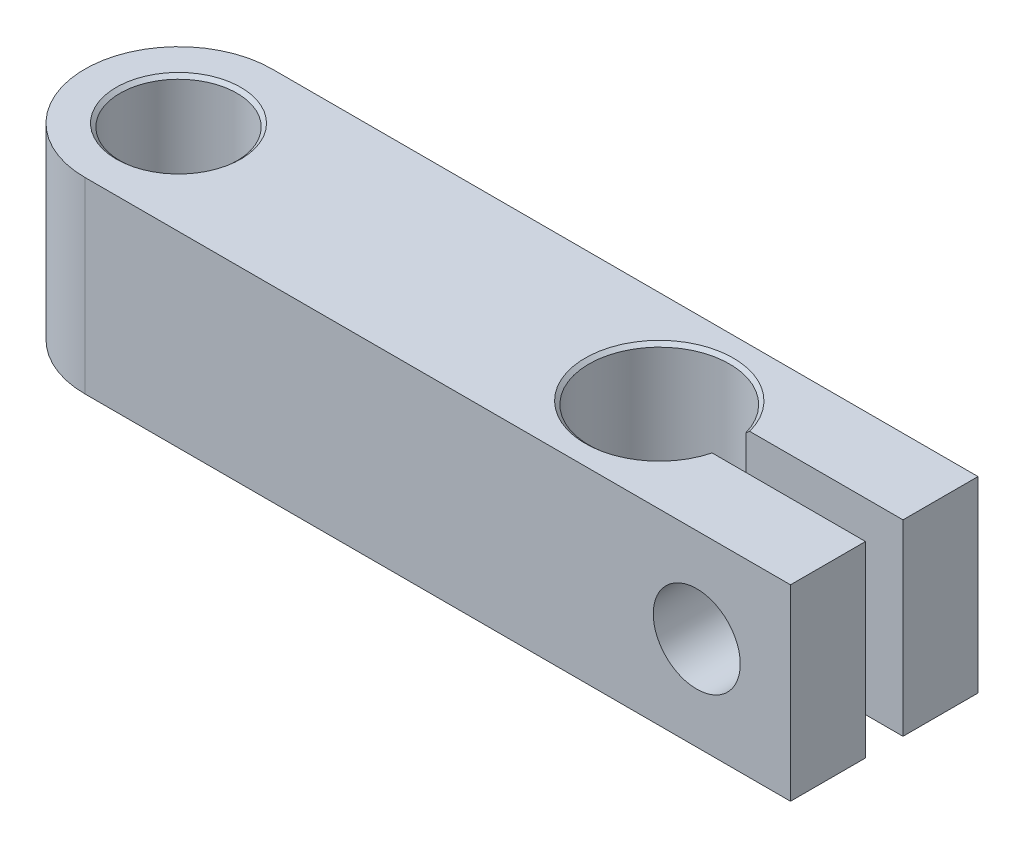
from build123d import *
from OCP.BRepFilletAPI import BRepFilletAPI_MakeChamfer

# Parameters (mm, degrees)
SKETCH1_R                  = 1.9812
SKETCH1_R_2                = 2.38125
BOSS_EXTRUDE1_DEPTH        = 6.35
SKETCH2_W                  = 7.62
SKETCH2_H                  = 1.27
CUT_EXTRUDE1_DEPTH         = 26.532761738
CHAMFER1_SIZE              = 0.127
CHAMFER1_SIZE2             = 0.110399416
F_4_40_TAPPED_HOLE1_REACH  = 27.533
F_4_40_TAPPED_HOLE1_BORE_R = 1.1303
SKETCH5_R                  = 1.4732
CUT_EXTRUDE2_DEPTH         = 2.54


with BuildPart() as part:
    # Sketch1 → Boss-Extrude1 (new body)
    with BuildSketch(Plane(origin=(0, 0, 0), x_dir=(1, 0, 0), z_dir=(0, 1, 0))):
        with BuildLine():
            Line((0, 0), (23.9014, 0))
            Line((23.9014, 0), (23.9014, 6.35))
            Line((23.9014, 6.35), (0, 6.35))
            ThreePointArc((0, 6.35), (-3.175, 3.175), (0, 0))
        make_face()
        with Locations(Location((0, 3.175, 0), (0, 0, 270))):
            Circle(SKETCH1_R, mode=Mode.SUBTRACT)
        with Locations(Location((16.2814, 3.175, 0), (0, 0, 270))):
            Circle(SKETCH1_R_2, mode=Mode.SUBTRACT)
    extrude(amount=BOSS_EXTRUDE1_DEPTH)

    # Sketch2 → Cut-Extrude1 (cut, through all)
    with BuildSketch(Plane(origin=(0, 6.35, 0), x_dir=(1, 0, 0), z_dir=(0, 1, 0))):
        with Locations((20.0914, 3.175)):
            Rectangle(SKETCH2_W, SKETCH2_H)
    extrude(amount=-CUT_EXTRUDE1_DEPTH, mode=Mode.SUBTRACT)

    # Chamfer1: one chamfer whose edges measure the first distance from different faces: ONE call of the kernel's chamfer builder (chamfer() names one face for all edges)
    chamfer1_edges_1 = [part.edges().sort_by_distance(p)[0] for p in [
        (0, 0, -5.1562),
    ]]
    chamfer1_side_1 = [part.faces().sort_by_distance(p)[0] for p in [
        (0, 3.175, -5.1562),
    ]]
    chamfer1_edges_2 = [part.edges().sort_by_distance(p)[0] for p in [
        (0, 6.35, -5.1562),
        (13.90015, 6.35, -3.175),
    ]]
    chamfer1_side_2 = [part.faces().sort_by_distance(p)[0] for p in [
        (10.400868542, 6.35, -3.175),
    ]]
    chamfer1_edges_3 = [part.edges().sort_by_distance(p)[0] for p in [
        (13.90015, 0, -3.175),
    ]]
    chamfer1_side_3 = [part.faces().sort_by_distance(p)[0] for p in [
        (13.90015, 3.175, -3.175),
    ]]
    chamfer1 = BRepFilletAPI_MakeChamfer(part.part.solid().wrapped)
    for e in chamfer1_edges_1:
        chamfer1.Add(CHAMFER1_SIZE, CHAMFER1_SIZE2, e.wrapped, chamfer1_side_1[0].wrapped)  # the first distance lies on this face
    for e in chamfer1_edges_2:
        chamfer1.Add(CHAMFER1_SIZE, CHAMFER1_SIZE2, e.wrapped, chamfer1_side_2[0].wrapped)  # the first distance lies on this face
    for e in chamfer1_edges_3:
        chamfer1.Add(CHAMFER1_SIZE, CHAMFER1_SIZE2, e.wrapped, chamfer1_side_3[0].wrapped)  # the first distance lies on this face
    add(Compound.cast(chamfer1.Shape()), mode=Mode.REPLACE)

    # #4-40 Tapped Hole1 bore → #4-40 Tapped Hole1 (cut, up to next)
    with BuildSketch(Plane(origin=(0, 0, -6.35), x_dir=(-1, 0, 0), z_dir=(0, 0, -1)), mode=Mode.PRIVATE) as f_4_40_tapped_hole1_sk1:
        with Locations((-20.7264, 3.175)):
            Circle(F_4_40_TAPPED_HOLE1_BORE_R)
    f_4_40_tapped_hole1_tool1 = extrude(f_4_40_tapped_hole1_sk1.sketch, amount=-F_4_40_TAPPED_HOLE1_REACH, mode=Mode.PRIVATE) & part.part
    add(f_4_40_tapped_hole1_tool1.solids().sort_by_distance((20.7264, 3.175, -6.35))[0], mode=Mode.SUBTRACT)

    # Sketch5 → Cut-Extrude2 (cut)
    with BuildSketch(Plane.XY):
        with Locations((20.7264, 3.175)):
            Circle(SKETCH5_R)
    extrude(amount=-CUT_EXTRUDE2_DEPTH, mode=Mode.SUBTRACT)


solid = part.part
